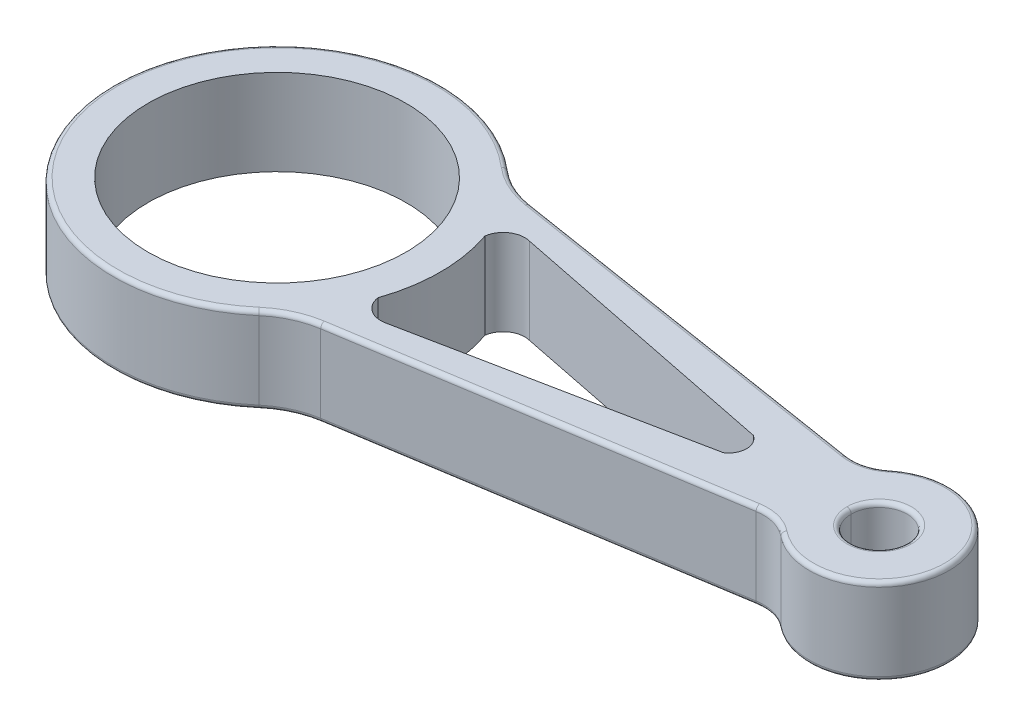
from build123d import *

# Parameters (mm, degrees)
SKETCH1_R           = 30
SKETCH1_R_2         = 6.5
BOSS_EXTRUDE1_DEPTH = 10
FILLET1_R           = 20
FILLET2_R           = 10
CUT_EXTRUDE1_DEPTH  = 163.043396965
FILLET3_R           = 1


with BuildPart() as part:
    # Sketch1 → Boss-Extrude1 (new, symmetric)
    with BuildSketch(Plane(origin=(0, 0, 0), x_dir=(1, 0, 0), z_dir=(0, 1, 0))):
        with BuildLine():
            Line((28.309347234, -25.349178669), (126.979372859, -9.722436364))
            ThreePointArc((126.979372859, -9.722436364), (156.25, 0), (126.979372859, 9.722436364))
            Line((126.979372859, 9.722436364), (28.309347234, 25.349178669))
            ThreePointArc((28.309347234, 25.349178669), (-38, 0), (28.309347234, -25.349178669))
        make_face()
        with Locations(Location((0, 0, 0), (0, 0, 270))):
            Circle(SKETCH1_R, mode=Mode.SUBTRACT)
        with Locations(Location((140, 0, 0), (0, 0, 270))):
            Circle(SKETCH1_R_2, mode=Mode.SUBTRACT)
    extrude(amount=BOSS_EXTRUDE1_DEPTH, both=True)

    # Fillet1
    fillet1_edges = [part.edges().sort_by_distance(p)[0] for p in [
        (28.309347234, 0, -25.349178669),
        (28.309347234, 0, 25.349178669),
    ]]
    fillet(fillet1_edges, radius=FILLET1_R)

    # Fillet2
    fillet2_edges = [part.edges().sort_by_distance(p)[0] for p in [
        (126.979372859, 0, -9.722436364),
        (126.979372859, 0, 9.722436364),
    ]]
    fillet(fillet2_edges, radius=FILLET2_R)

    # Sketch2 → Cut-Extrude1 (cut, through all)
    with BuildSketch(Plane.XZ.offset(10)):
        with BuildLine():
            Line((42.084593021, -16.586528838), (107.258618966, -3.493133042))
            ThreePointArc((107.258618966, -3.493133042), (109.159728126, 0), (107.258618966, 3.493133042))
            Line((107.258618966, 3.493133042), (42.084593021, 16.586528838))
            ThreePointArc((42.084593021, 16.586528838), (38.071391156, 15.895857226), (35.902950989, 12.449020454))
            ThreePointArc((35.902950989, 12.449020454), (38, 0), (35.902950989, -12.449020454))
            ThreePointArc((35.902950989, -12.449020454), (38.071391156, -15.895857226), (42.084593021, -16.586528838))
        make_face()
    extrude(amount=-CUT_EXTRUDE1_DEPTH, mode=Mode.SUBTRACT)

    # Fillet3
    fillet3_edges = [part.edges().sort_by_distance(p)[0] for p in [
        (140, -10, -6.5),
        (140, 10, -6.5),
        (-38, -10, 0),
        (-38, 10, 0),
        (78.219231742, -10, 17.444762928),
        (78.219231742, 10, 17.444762928),
        (29.280338441, -10, -25.954540832),
        (29.280338441, 10, -25.954540832),
        (29.280338441, -10, 25.954540832),
        (29.280338441, 10, 25.954540832),
        (78.219231742, -10, -17.444762928),
        (78.219231742, 10, -17.444762928),
        (156.25, -10, 0),
        (156.25, 10, 0),
        (126.069482803, -10, -10.74171894),
        (126.069482803, 10, -10.74171894),
        (126.069482803, -10, 10.74171894),
        (126.069482803, 10, 10.74171894),
        (140, -10, -6.5),
        (140, 10, -6.5),
    ]]
    fillet(fillet3_edges, radius=FILLET3_R)


solid = part.part
